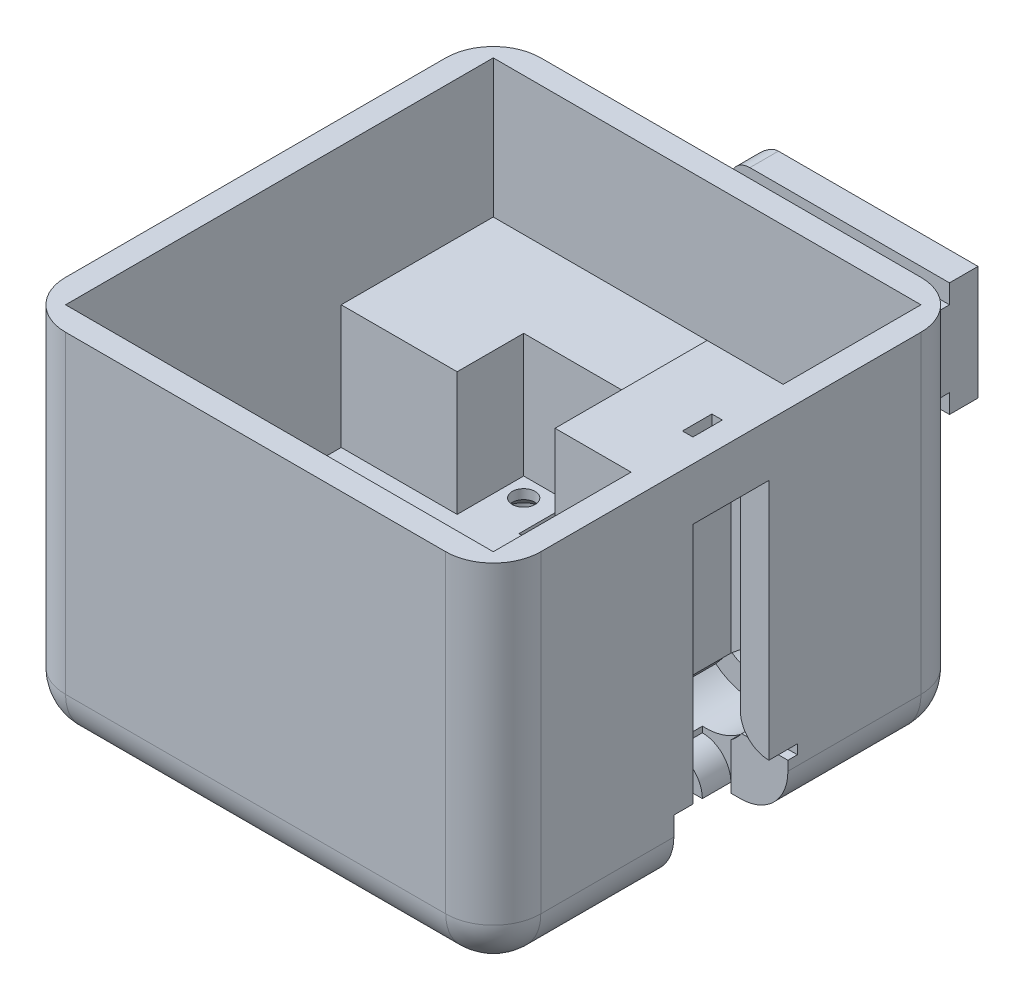
from build123d import *

# Parameters (mm, degrees)
SKETCH1_W                                      = 50
SKETCH1_H                                      = 50
BOSS_EXTRUDE1_DEPTH                            = 38
SHELL1_T                                       = -2.5
BOSS_EXTRUDE2_DEPTH                            = 21
SKETCH3_W                                      = 45
SKETCH3_H                                      = 16
BOSS_EXTRUDE3_DEPTH                            = 8
SKETCH4_W                                      = 32.5
SKETCH4_H                                      = 8
CUT_EXTRUDE1_DEPTH                             = 3
SKETCH7_W                                      = 32.5
SKETCH7_H                                      = 12
CUT_EXTRUDE2_DEPTH                             = 3
SKETCH8_W                                      = 16
SKETCH8_H                                      = 27.5
BOSS_EXTRUDE4_DEPTH                            = 8
SKETCH9_W                                      = 8
SKETCH9_H                                      = 32.5
CUT_EXTRUDE3_DEPTH                             = 3
CUT_EXTRUDE5_DEPTH                             = 3
CUT_EXTRUDE7_DEPTH                             = 10
CUT_EXTRUDE7_DEPTH_BACK                        = 2
SKETCH13_W                                     = 3
SKETCH13_H                                     = 3.011524732
FILLET1_R                                      = 5
SKETCH16_R                                     = 1.8
CUT_EXTRUDE8_DEPTH                             = 53.642663306
SKETCH17_W                                     = 23
SKETCH17_H                                     = 12
BOSS_EXTRUDE5_DEPTH                            = 6
SKETCH18_W                                     = 3
SKETCH18_H                                     = 2
CUT_EXTRUDE9_DEPTH                             = 57.471231614
CUT_EXTRUDE12_DEPTH                            = 2
CUT_EXTRUDE13_DEPTH                            = 2
CUT_EXTRUDE14_DEPTH                            = 16
CUT_EXTRUDE10_START                            = -19.5
CUT_EXTRUDE10_DEPTH                            = 19.5
FILLET4_R                                      = 2
BOSS_EXTRUDE6_DEPTH                            = 4.5
SKETCH30_W                                     = 4.34
SKETCH30_H                                     = 1.8
CUT_EXTRUDE19_DEPTH                            = 4.4
SKETCH31_W                                     = 1.8
SKETCH31_H                                     = 4.34
CUT_EXTRUDE20_DEPTH                            = 4.4
SKETCH32_W                                     = 1.1
SKETCH32_H                                     = 3.1
CUT_EXTRUDE21_DEPTH                            = 55.291896265
SKETCH33_W                                     = 3.1
SKETCH33_H                                     = 1.1
CUT_EXTRUDE22_DEPTH                            = 3.55
SKETCH34_W                                     = 2
SKETCH34_H                                     = 3.1
CUT_EXTRUDE23_DEPTH                            = 7.3
SKETCH35_W                                     = 5
SKETCH35_H                                     = 5.5
BOSS_EXTRUDE7_DEPTH                            = 8
SKETCH36_W                                     = 5
SKETCH36_H                                     = 6
BOSS_EXTRUDE8_DEPTH                            = 8
CSK_SLOT_FOR_M2_COUNTERSUNK_FLAT_HEA_2_COUNT   = 2
CSK_SLOT_FOR_M2_COUNTERSUNK_FLAT_HEA_2_PITCH   = 16.6
CSK_SLOT_FOR_M2_COUNTERSUNK_FLAT_HEA_3_A_COUNT = 2
CSK_SLOT_FOR_M2_COUNTERSUNK_FLAT_HEA_3_A_PITCH = 16.6
SKETCH45_R                                     = 3.575
CUT_EXTRUDE27_DEPTH                            = 20
SKETCH46_W                                     = 1.850257739
SKETCH46_H                                     = 4
SKETCH46_W_2                                   = 4
SKETCH46_H_2                                   = 1.850257739
CUT_EXTRUDE28_DEPTH                            = 1
CUT_EXTRUDE25_START                            = -3
CUT_EXTRUDE25_DEPTH                            = 3
CUT_EXTRUDE24_START                            = -3
CUT_EXTRUDE24_DEPTH                            = 3
CUT_EXTRUDE29_DEPTH                            = 2


with BuildPart() as part:
    # Sketch1 → Boss-Extrude1 (new body)
    with BuildSketch(Plane(origin=(0, 0, 0), x_dir=(1, 0, 0), z_dir=(0, 1, 0))):
        Rectangle(SKETCH1_W, SKETCH1_H)
    extrude(amount=BOSS_EXTRUDE1_DEPTH)

    # Shell1
    shell1_openings = [part.faces().sort_by_distance(p)[0] for p in [
        (0, 38, 0),
    ]]
    offset(amount=SHELL1_T, openings=shell1_openings, kind=Kind.INTERSECTION)

    # Sketch2 → Boss-Extrude2 (add)
    with BuildSketch(Plane(origin=(0, 2.5, 0), x_dir=(1, 0, 0), z_dir=(0, 1, 0))):
        Polygon((-10.3, -13.6), (-22.5, -13.6), (-22.5, -22.5), (0.190053949, -22.5), (22.5, -22.5), (22.5, -13.355593994), (10.3, -13.355593994), (10.3, -20.79), (0.190053949, -20.79), (-10.3, -20.79), align=None)
        Polygon((-22.5, 6.5), (-10.3, 6.5), (-10.3, 13.5), (0, 13.5), (10.3, 13.5), (10.3, 7.28), (22.5, 7.28), (22.5, 22.5), (0, 22.5), (-22.5, 22.5), align=None)
    extrude(amount=BOSS_EXTRUDE2_DEPTH)

    # Sketch3 → Boss-Extrude3 (add)
    with BuildSketch(Plane(origin=(0, 2.5, 0), x_dir=(1, 0, 0), z_dir=(0, 1, 0))):
        Rectangle(SKETCH3_W, SKETCH3_H)
    extrude(amount=BOSS_EXTRUDE3_DEPTH)

    # Sketch4 → Cut-Extrude1 (cut)
    with BuildSketch(Plane.XZ):
        with Locations((8.75, 0)):
            Rectangle(SKETCH4_W, SKETCH4_H)
    extrude(amount=-CUT_EXTRUDE1_DEPTH, mode=Mode.SUBTRACT)

    # Sketch7 → Cut-Extrude2 (cut)
    with BuildSketch(Plane(origin=(0, 3, 0), x_dir=(-1, 0, 0), z_dir=(0, -1, 0))):
        with Locations((-8.75, 0)):
            Rectangle(SKETCH7_W, SKETCH7_H)
    extrude(amount=-CUT_EXTRUDE2_DEPTH, mode=Mode.SUBTRACT)

    # Sketch8 → Boss-Extrude4 (add)
    with BuildSketch(Plane.ZY.offset(-22.5)):
        with Locations((0, 24.25)):
            Rectangle(SKETCH8_W, SKETCH8_H)
    extrude(amount=BOSS_EXTRUDE4_DEPTH)

    # Sketch9 → Cut-Extrude3 (cut)
    with BuildSketch(Plane(origin=(25, 0, 0), x_dir=(0, 0, -1), z_dir=(1, 0, 0))):
        with Locations((0, 16.25)):
            Rectangle(SKETCH9_W, SKETCH9_H)
    extrude(amount=-CUT_EXTRUDE3_DEPTH, mode=Mode.SUBTRACT)

    # Sketch10 → Cut-Extrude5 (cut)
    with BuildSketch(Plane(origin=(22, 0, 0), x_dir=(0, 0, -1), z_dir=(1, 0, 0))):
        Polygon((-6, 32.5), (-6, 0), (6, 0), (6, 3), (6, 32.5), align=None)
    extrude(amount=-CUT_EXTRUDE5_DEPTH, mode=Mode.SUBTRACT)

    # Sketch13 → Cut-Extrude7 (cut, two sides: drawn at the far end of the back side and taken through both)
    with BuildSketch(Plane(origin=(0, 0, 4), x_dir=(-1, 0, 0), z_dir=(0, 0, -1)).offset(-CUT_EXTRUDE7_DEPTH_BACK)):
        with Locations((-23.5, 1.505762366)):
            Rectangle(SKETCH13_W, SKETCH13_H)
    extrude(amount=CUT_EXTRUDE7_DEPTH + CUT_EXTRUDE7_DEPTH_BACK, mode=Mode.SUBTRACT)

    # Fillet1
    fillet1_edges = [part.edges().sort_by_distance(p)[0] for p in [
        (25, 0, -15.5),
        (0, 0, -25),
        (25, 0, 15.5),
        (0, 0, 25),
        (-25, 0, 0),
        (-25, 19, -25),
        (25, 19, -25),
        (25, 19, 25),
        (-25, 19, 25),
    ]]
    fillet(fillet1_edges, radius=FILLET1_R)

    # Sketch16 → Cut-Extrude8 (cut, through all)
    with BuildSketch(Plane(origin=(0, 0, 1.5), x_dir=(-1, 0, 0), z_dir=(0, 0, -1))):
        with Locations(Location((-15.3, 9.7, 0), (0, 0, 63.612200039))):
            Circle(SKETCH16_R)
    extrude(amount=CUT_EXTRUDE8_DEPTH, mode=Mode.SUBTRACT)

    # Sketch17 → Boss-Extrude5 (add)
    with BuildSketch(Plane(origin=(0, 0, -25), x_dir=(-1, 0, 0), z_dir=(0, 0, -1))):
        with Locations((-8.5, 30)):
            Rectangle(SKETCH17_W, SKETCH17_H)
    extrude(amount=BOSS_EXTRUDE5_DEPTH)

    # Sketch18 → Cut-Extrude9 (cut, through all)
    with BuildSketch(Plane.ZY.offset(3)):
        with Locations((-26.5, 25)):
            Rectangle(SKETCH18_W, SKETCH18_H)
        with Locations((-26.5, 35)):
            Rectangle(SKETCH18_W, SKETCH18_H)
    extrude(amount=-CUT_EXTRUDE9_DEPTH, mode=Mode.SUBTRACT)

    # Sketch20 → Cut-Extrude12 (cut)
    with BuildSketch(Plane(origin=(0, 0, 4), x_dir=(-1, 0, 0), z_dir=(0, 0, -1))):
        with BuildLine():
            Line((-22, 10), (-22, 7))
            Line((-22, 7), (-22, 6))
            Line((-22, 6), (-24, 6))
            Line((-24, 6), (-25, 6))
            Line((-25, 6), (-25, 7))
            ThreePointArc((-25, 7), (-22.878679656, 7.878679656), (-22, 10))
        make_face()
    extrude(amount=-CUT_EXTRUDE12_DEPTH, mode=Mode.SUBTRACT)

    # Sketch21 → Cut-Extrude13 (cut)
    with BuildSketch(Plane(origin=(0, 0, 4), x_dir=(-1, 0, 0), z_dir=(0, 0, -1))):
        with BuildLine():
            Line((-19, 3), (-19, 0))
            Line((-19, 0), (-18, 0))
            ThreePointArc((-18, 0), (-17.121320344, 2.121320344), (-15, 3))
            Line((-15, 3), (-19, 3))
        make_face()
    extrude(amount=-CUT_EXTRUDE13_DEPTH, mode=Mode.SUBTRACT)

    # Sketch22 → Cut-Extrude14 (cut)
    with BuildSketch(Plane(origin=(0, 0, 4), x_dir=(-1, 0, 0), z_dir=(0, 0, -1))):
        with BuildLine():
            Line((-15.3, 9.7), (-11.411555581, 5))
            ThreePointArc((-11.411555581, 5), (-19.613351365, 5.386648635), (-20, 13.588444419))
            Line((-20, 13.588444419), (-15.3, 9.7))
        make_face()
    extrude(amount=CUT_EXTRUDE14_DEPTH, mode=Mode.SUBTRACT)

    # Sketch19 → Cut-Extrude10 (cut)
    with BuildSketch(Plane(origin=(0, 0, -25), x_dir=(-1, 0, 0), z_dir=(0, 0, -1)).offset(CUT_EXTRUDE10_START)):
        with BuildLine():
            ThreePointArc((-16.123011235, 8.099171306), (-16.572792206, 8.427207794), (-16.900828694, 8.876988765))
            Line((-16.900828694, 8.876988765), (-17.43115878, 8.346658679))
            Line((-17.43115878, 8.346658679), (-16.653341321, 7.56884122))
            Line((-16.653341321, 7.56884122), (-16.123011235, 8.099171306))
        make_face()
        with BuildLine():
            ThreePointArc((-14.476988765, 11.300828694), (-14.027207794, 10.972792206), (-13.699171306, 10.523011235))
            Line((-13.699171306, 10.523011235), (-13.16884122, 11.053341321))
            Line((-13.16884122, 11.053341321), (-13.946658679, 11.83115878))
            Line((-13.946658679, 11.83115878), (-14.476988765, 11.300828694))
        make_face()
    extrude(amount=CUT_EXTRUDE10_DEPTH, mode=Mode.SUBTRACT)

    # Fillet4
    fillet4_edges = [part.edges().sort_by_distance(p)[0] for p in [
        (-3, 36, -29.5),
        (-3, 24, -29.5),
        (-3, 30, -31),
    ]]
    fillet(fillet4_edges, radius=FILLET4_R)

    # Sketch29 → Boss-Extrude6 (add)
    with BuildSketch(Plane(origin=(0, 0, 6), x_dir=(-1, 0, 0), z_dir=(0, 0, -1))):
        with BuildLine():
            Line((-16.499079266, 10.69203257), (-15.305377807, 9.639286837))
            Line((-15.305377807, 9.639286837), (-14.258167132, 8.440726637))
            ThreePointArc((-14.258167132, 8.440726637), (-14.177344347, 10.762112408), (-16.499079266, 10.69203257))
        make_face()
    extrude(amount=BOSS_EXTRUDE6_DEPTH)

    # Sketch30 → Cut-Extrude19 (cut)
    with BuildSketch(Plane(origin=(-7.5, 0, 0), x_dir=(0, 0, -1), z_dir=(1, 0, 0))):
        with Locations((0, 3)):
            Rectangle(SKETCH30_W, SKETCH30_H)
    extrude(amount=-CUT_EXTRUDE19_DEPTH, mode=Mode.SUBTRACT)

    # Sketch31 → Cut-Extrude20 (cut)
    with BuildSketch(Plane.XZ.offset(-32.5)):
        with Locations((22, 0)):
            Rectangle(SKETCH31_W, SKETCH31_H)
    extrude(amount=-CUT_EXTRUDE20_DEPTH, mode=Mode.SUBTRACT)

    # Sketch32 → Cut-Extrude21 (cut, through all)
    with BuildSketch(Plane.XZ.offset(-36.9)):
        with Locations((22, 0)):
            Rectangle(SKETCH32_W, SKETCH32_H)
    extrude(amount=-CUT_EXTRUDE21_DEPTH, mode=Mode.SUBTRACT)

    # Sketch33 → Cut-Extrude22 (cut)
    with BuildSketch(Plane(origin=(-11.9, 0, 0), x_dir=(0, 0, -1), z_dir=(1, 0, 0))):
        with Locations((0, 3)):
            Rectangle(SKETCH33_W, SKETCH33_H)
    extrude(amount=-CUT_EXTRUDE22_DEPTH, mode=Mode.SUBTRACT)

    # Sketch34 → Cut-Extrude23 (cut)
    with BuildSketch(Plane(origin=(0, 10.5, 0), x_dir=(1, 0, 0), z_dir=(0, 1, 0))):
        with Locations((-14.45, 0)):
            Rectangle(SKETCH34_W, SKETCH34_H)
    extrude(amount=-CUT_EXTRUDE23_DEPTH, mode=Mode.SUBTRACT)

    # Sketch35 → Boss-Extrude7 (add)
    with BuildSketch(Plane(origin=(0, 2.5, 0), x_dir=(1, 0, 0), z_dir=(0, 1, 0))):
        with Locations((7.8, 10.75)):
            Rectangle(SKETCH35_W, SKETCH35_H)
        with Locations((-7.8, 10.75)):
            Rectangle(SKETCH35_W, SKETCH35_H)
    extrude(amount=BOSS_EXTRUDE7_DEPTH)

    # Sketch36 → Boss-Extrude8 (add)
    with BuildSketch(Plane(origin=(0, 2.5, 0), x_dir=(1, 0, 0), z_dir=(0, 1, 0))):
        with Locations((-7.8, -17.79)):
            Rectangle(SKETCH36_W, SKETCH36_H)
        with Locations((7.8, -17.79)):
            Rectangle(SKETCH36_W, SKETCH36_H)
    extrude(amount=BOSS_EXTRUDE8_DEPTH)

    # Sketch39 → CSK SLOT for M2 Countersunk Flat Head Sc (revolve, cut)
    with BuildSketch(Plane(origin=(8.3, 0, -11.5), x_dir=(0, 0, -1), z_dir=(1, 0, 0))):
        Polygon((0, 0), (0, 11.221032743), (1.2, 10.5), (1.2, 9.5), (2.2, 8.5), (2.2, 0), align=None)
    csk_slot_for_m2_countersunk_flat_head_sc = revolve(axis=Axis((8.3, -6.35, -11.5), (0, 1, 0)), mode=Mode.SUBTRACT)

    # CSK SLOT for M2 Countersunk Flat Hea 2: CSK SLOT for M2 Countersunk Flat Head Sc ×2
    with Locations(*[(-i * CSK_SLOT_FOR_M2_COUNTERSUNK_FLAT_HEA_2_PITCH, 0, 0) for i in range(1, CSK_SLOT_FOR_M2_COUNTERSUNK_FLAT_HEA_2_COUNT)]):
        add(csk_slot_for_m2_countersunk_flat_head_sc, mode=Mode.SUBTRACT)

    # Sketch41 → CSK SLOT for M2 Countersunk Flat Hea 3 (revolve, cut)
    with BuildSketch(Plane(origin=(8.3, 0, 18.79), x_dir=(0, 0, -1), z_dir=(1, 0, 0))):
        Polygon((0, 0), (0, 11.221032743), (1.2, 10.5), (1.2, 9.5), (2.2, 8.5), (2.2, 0), align=None)
    csk_slot_for_m2_countersunk_flat_hea_3 = revolve(axis=Axis((8.3, -6.35, 18.79), (0, 1, 0)), mode=Mode.SUBTRACT)

    # CSK SLOT for M2 Countersunk Flat Hea 3 a: CSK SLOT for M2 Countersunk Flat Hea 3 ×2
    with Locations(*[(-i * CSK_SLOT_FOR_M2_COUNTERSUNK_FLAT_HEA_3_A_PITCH, 0, 0) for i in range(1, CSK_SLOT_FOR_M2_COUNTERSUNK_FLAT_HEA_3_A_COUNT)]):
        add(csk_slot_for_m2_countersunk_flat_hea_3, mode=Mode.SUBTRACT)

    # Sketch45 → Cut-Extrude27 (cut)
    with BuildSketch(Plane(origin=(0, 0, 1.5), x_dir=(-1, 0, 0), z_dir=(0, 0, -1))):
        with Locations(Location((-15.3, 9.7, 0), (0, 0, 140.398072919))):
            Circle(SKETCH45_R)
    extrude(amount=CUT_EXTRUDE27_DEPTH, mode=Mode.SUBTRACT)

    # Sketch46 → Cut-Extrude28 (cut)
    with BuildSketch(Plane.XY.offset(-6)):
        with Locations((21.074871131, 8)):
            Rectangle(SKETCH46_W, SKETCH46_H)
        with Locations((17, 3.925128869)):
            Rectangle(SKETCH46_W_2, SKETCH46_H_2)
    extrude(amount=-CUT_EXTRUDE28_DEPTH, mode=Mode.SUBTRACT)

    # Sketch43 → Cut-Extrude25 (cut)
    with BuildSketch(Plane.XY.offset(-4).offset(CUT_EXTRUDE25_START)):
        with BuildLine():
            Line((19, 0), (18, 0))
            ThreePointArc((18, 0), (17.121320344, 2.121320344), (15, 3))
            Line((15, 3), (19, 3))
            Line((19, 3), (19, 0))
        make_face()
    extrude(amount=CUT_EXTRUDE25_DEPTH, mode=Mode.SUBTRACT)

    # Sketch42 → Cut-Extrude24 (cut)
    with BuildSketch(Plane.XY.offset(-4).offset(CUT_EXTRUDE24_START)):
        with BuildLine():
            Line((22, 6), (25, 6))
            Line((25, 6), (25, 7))
            ThreePointArc((25, 7), (22.878679656, 7.878679656), (22, 10))
            Line((22, 10), (22, 6))
        make_face()
    extrude(amount=CUT_EXTRUDE24_DEPTH, mode=Mode.SUBTRACT)

    # Sketch47 → Cut-Extrude29 (cut)
    with BuildSketch(Plane(origin=(0, 0, 4), x_dir=(-1, 0, 0), z_dir=(0, 0, -1))):
        Polygon((-19, 12.761115819), (-16.499079266, 10.69203257), (-15.305377807, 9.639286837), (-14.258167132, 8.440726637), (-12.238884181, 6), (-19, 6), align=None)
    extrude(amount=-CUT_EXTRUDE29_DEPTH, mode=Mode.SUBTRACT)


solid = part.part
